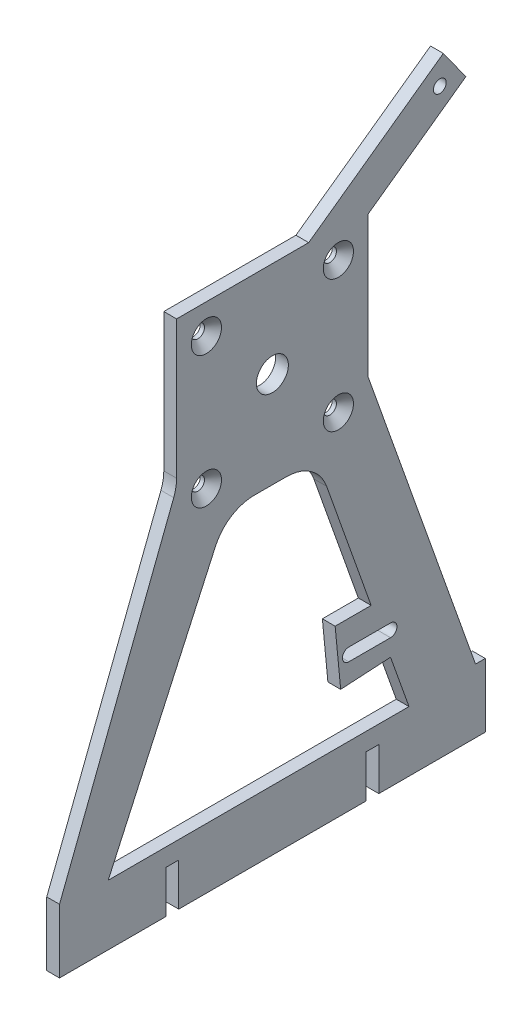
from build123d import *

# Parameters (mm, degrees)
SKETCH1_W           = 45
SKETCH1_H           = 45
SKETCH1_R           = 1.55
SKETCH1_R_2         = 3.75
SKETCH1_R_3         = 1.5
BOSS_EXTRUDE2_DEPTH = 3
CHAMFER1_SIZE       = 2
FILLET2_R           = 10


with BuildPart() as part:
    # Sketch1 → Boss-Extrude2 (new body)
    # profile 1 of 3: a face of its own
    with BuildSketch(Plane(origin=(0, 0, 0), x_dir=(0, 0, -1), z_dir=(1, 0, 0))):
        Polygon((0, 15), (27.5, 86.038878339), (39.282646226, 75.31968933), (11.439152216, 14.16907058), (50, 14.16907058), (82.089729195, 14.16907058), (77.753857358, 26.374167507), (66.036256754, 25.688126343), (64.741637437, 39.196033454), (73.198877763, 39.196033454), (60.365916003, 75.31968933), (72.5, 85.972228566), (97.712949054, 15), (100, 15), (100, 0), (75, 0), (75, 10), (72, 10), (72, 0), (28, 0), (28, 10), (25, 10), (25, 0), (0, 0), align=None)
        with BuildLine():
            Line((67.956429084, 33.345444875), (77.753857358, 33.345444875))
            ThreePointArc((77.753857358, 33.345444875), (79.253857358, 31.845444875), (77.753857358, 30.345444875))
            Line((77.753857358, 30.345444875), (67.956429084, 30.345444875))
            ThreePointArc((67.956429084, 30.345444875), (66.456429084, 31.845444875), (67.956429084, 33.345444875))
        make_face(mode=Mode.SUBTRACT)
    # profile 2 of 3: a face of its own
    with BuildSketch(Plane(origin=(0, 0, 0), x_dir=(0, 0, -1), z_dir=(1, 0, 0))):
        with Locations((50, 97.81968933)):
            Rectangle(SKETCH1_W, SKETCH1_H)
        with Locations((34.5, 82.31968933)):
            Circle(SKETCH1_R, mode=Mode.SUBTRACT)
        with Locations((65.5, 82.31968933)):
            Circle(SKETCH1_R, mode=Mode.SUBTRACT)
        with Locations((65.5, 113.31968933)):
            Circle(SKETCH1_R, mode=Mode.SUBTRACT)
        with Locations((34.5, 113.31968933)):
            Circle(SKETCH1_R, mode=Mode.SUBTRACT)
        with Locations((50, 97.81968933)):
            Circle(SKETCH1_R_2, mode=Mode.SUBTRACT)
    # profile 3 of 3: a face of its own
    with BuildSketch(Plane(origin=(0, 0, 0), x_dir=(0, 0, -1), z_dir=(1, 0, 0))):
        Polygon((58.527688318, 120.31968933), (90.14613276, 143.005488448), (95.440133744, 135.626948458), (68.383623973, 116.214274737), align=None)
        with Locations((89.319967142, 136.74442097)):
            Circle(SKETCH1_R_3, mode=Mode.SUBTRACT)
    extrude(amount=BOSS_EXTRUDE2_DEPTH)

    # Chamfer1
    chamfer1_edges = [part.edges().sort_by_distance(p)[0] for p in [
        (3, 82.31968933, -32.95),
        (3, 113.31968933, -32.95),
        (3, 113.31968933, -63.95),
        (3, 82.31968933, -63.95),
    ]]
    chamfer(chamfer1_edges, length=CHAMFER1_SIZE)

    # Fillet2
    fillet2_edges = [part.edges().sort_by_distance(p)[0] for p in [
        (1.5, 86.038878339, -27.5),
        (1.5, 75.31968933, -60.365916003),
        (1.5, 75.31968933, -39.282646226),
    ]]
    fillet(fillet2_edges, radius=FILLET2_R)


solid = part.part
